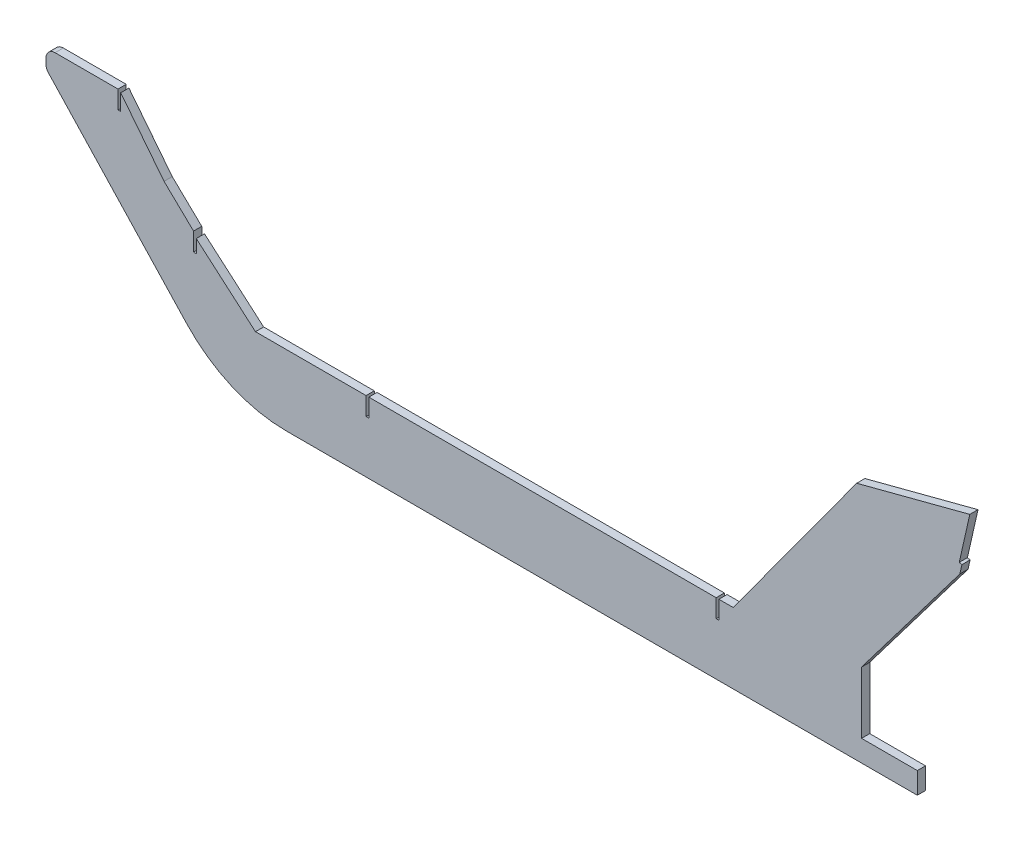
from build123d import *

# Parameters (mm, degrees)
BOSS_EXTRU_5_DEPTH      = 4.5
BOSS_EXTRU_5_DEPTH_BACK = 4.5
CONG_1_R                = 150
CONG_2_R                = 10


with BuildPart() as part:
    # Esquisse1 → Boss.-Extru.5 (new, two sides: drawn at the far end of the back side and taken through both)
    with BuildSketch(Plane.XY.offset(-BOSS_EXTRU_5_DEPTH_BACK)):
        Polygon((0, 0), (-758.779695033, 0), (-957.678777511, 212.988479036), (-957.678777511, 232.988479036), (-878.536330397, 232.988479036), (-878.536330397, 212.988479036), (-875.536330397, 212.988479036), (-875.536330397, 230.940110876), (-827.928204377, 170.423574705), (-795.486560581, 139.307598786), (-795.486560581, 119.307598786), (-792.486560581, 119.307598786), (-792.486560581, 133.699221334), (-727.464635299, 77.5420493), (-605.872801012, 77.5420493), (-605.872801012, 57.5420493), (-602.872801012, 57.5420493), (-602.872801012, 77.5420493), (-221.085552101, 77.5420493), (-221.085552101, 57.5420493), (-218.085552101, 57.5420493), (-218.085552101, 77.5420493), (-202.36477071, 77.5420493), (-66.626684698, 263.704257097), (57.709039867, 296.235629936), (46.096581547, 244.724780595), (49.02313659, 244.06502641), (46.758497819, 234.019481935), (-61.251050758, 91.440931648), (-61.251050758, 23.544195216), (0, 23.544195216), align=None)
    extrude(amount=BOSS_EXTRU_5_DEPTH + BOSS_EXTRU_5_DEPTH_BACK)

    # Congé1
    cong_1_edges = [part.edges().sort_by_distance(p)[0] for p in [
        (-758.779695033, 0, 0),
    ]]
    fillet(cong_1_edges, radius=CONG_1_R)

    # Congé2
    cong_2_edges = [part.edges().sort_by_distance(p)[0] for p in [
        (-957.678777511, 232.988479036, 0),
        (-957.678777511, 212.988479036, 0),
    ]]
    fillet(cong_2_edges, radius=CONG_2_R)


solid = part.part
